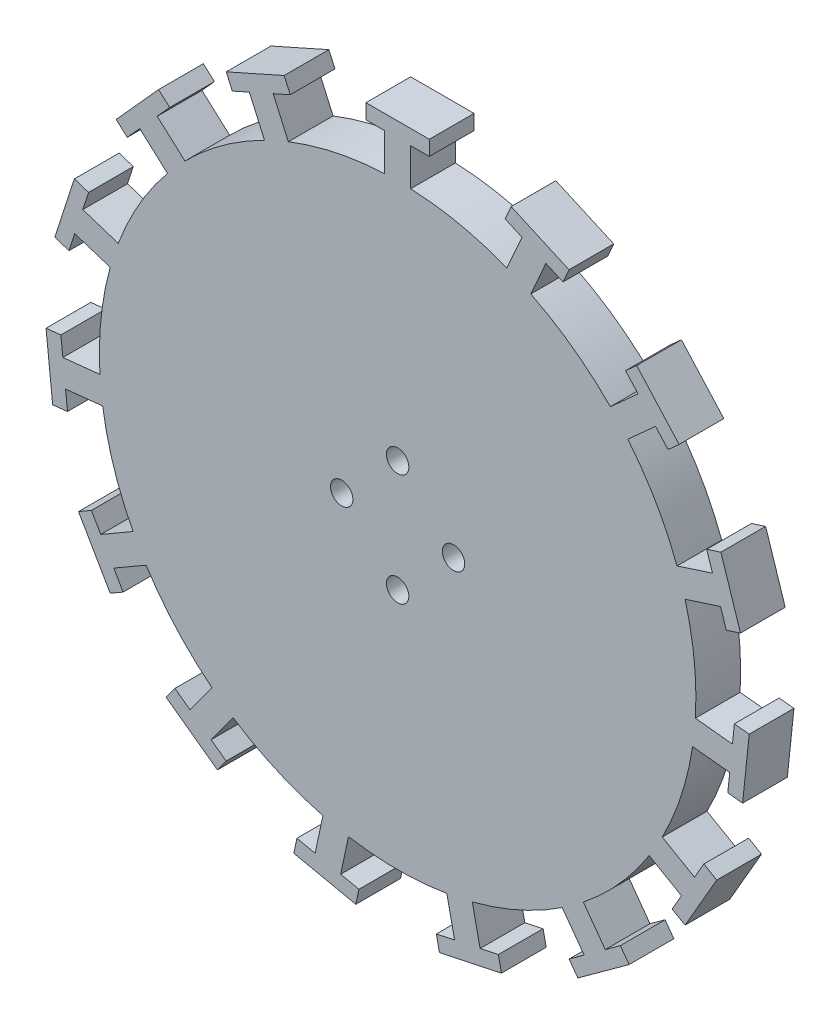
from build123d import *
from build123d.topology import SkipClean

# Parameters (mm, degrees)
SKETCH1_R           = 40
BOSS_EXTRUDE1_DEPTH = 2
BOSS_EXTRUDE2_DEPTH = 6
CIRPATTERN1_COUNT   = 15
SKETCH4_R           = 1.5
CUT_EXTRUDE2_DEPTH  = 10


with BuildPart() as part:
    # Sketch1 → Boss-Extrude1 (new body)
    with BuildSketch(Plane.XY):
        Circle(SKETCH1_R)
    extrude(amount=BOSS_EXTRUDE1_DEPTH)

    # Sketch6 → Boss-Extrude2 (add)
    with SkipClean():  # the faces are left unmerged after this step: merging them gives an invalid solid
        with BuildSketch(Plane.XY):
            with BuildLine():
                Line((-1.75, 39.961700414), (-1.75, 44.961700414))
                Line((-1.75, 44.961700414), (-4.25, 44.961700414))
                Line((-4.25, 44.961700414), (-4.25, 46.961700414))
                Line((-4.25, 46.961700414), (4.25, 46.961700414))
                Line((4.25, 46.961700414), (4.25, 44.961700414))
                Line((4.25, 44.961700414), (1.75, 44.961700414))
                Line((1.75, 44.961700414), (1.75, 39.961700414))
                ThreePointArc((1.75, 39.961700414), (0, -40), (-1.75, 39.961700414))
            make_face()
        boss_extrude2 = extrude(amount=BOSS_EXTRUDE2_DEPTH)

    # CirPattern1: Boss-Extrude2 ×15 about axis
    cirpattern1_axis = Axis((0, 0, 0), (0, 0, 1))
    for i in range(1, CIRPATTERN1_COUNT):
        add(boss_extrude2.rotate(cirpattern1_axis, i * 360 / CIRPATTERN1_COUNT))

    # Sketch4 → Cut-Extrude2 (cut, symmetric)
    with BuildSketch(Plane.XY.offset(2)):
        with Locations((0, 7.5)):
            Circle(SKETCH4_R)
        with Locations((7.5, 0)):
            Circle(SKETCH4_R)
        with Locations((0, -7.5)):
            Circle(SKETCH4_R)
        with Locations((-7.5, 0)):
            Circle(SKETCH4_R)
    extrude(amount=CUT_EXTRUDE2_DEPTH, both=True, mode=Mode.SUBTRACT)


solid = part.part
